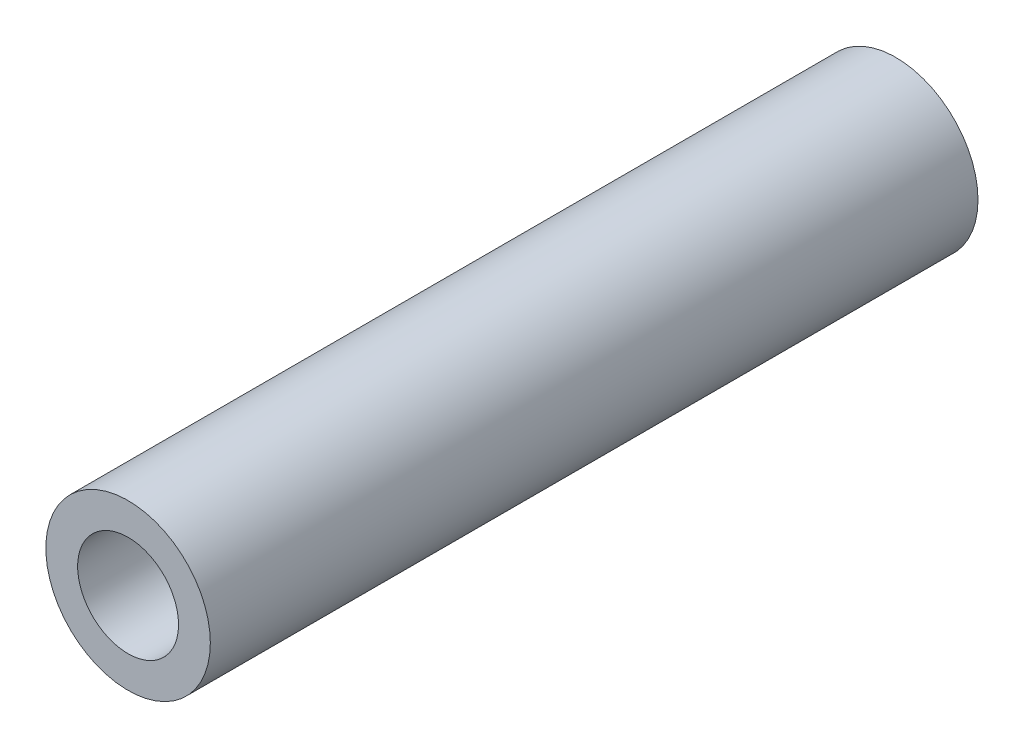
from build123d import *

# Parameters (mm, degrees)
SKETCH1_R      = 2.38125
SKETCH1_R_2    = 1.4605
EXTRUDE1_DEPTH = 11.1125


with BuildPart() as part:
    # Sketch1 → Extrude1 (new, symmetric)
    with BuildSketch(Plane.XY):
        Circle(SKETCH1_R)
        Circle(SKETCH1_R_2, mode=Mode.SUBTRACT)
    extrude(amount=EXTRUDE1_DEPTH, both=True)


solid = part.part
